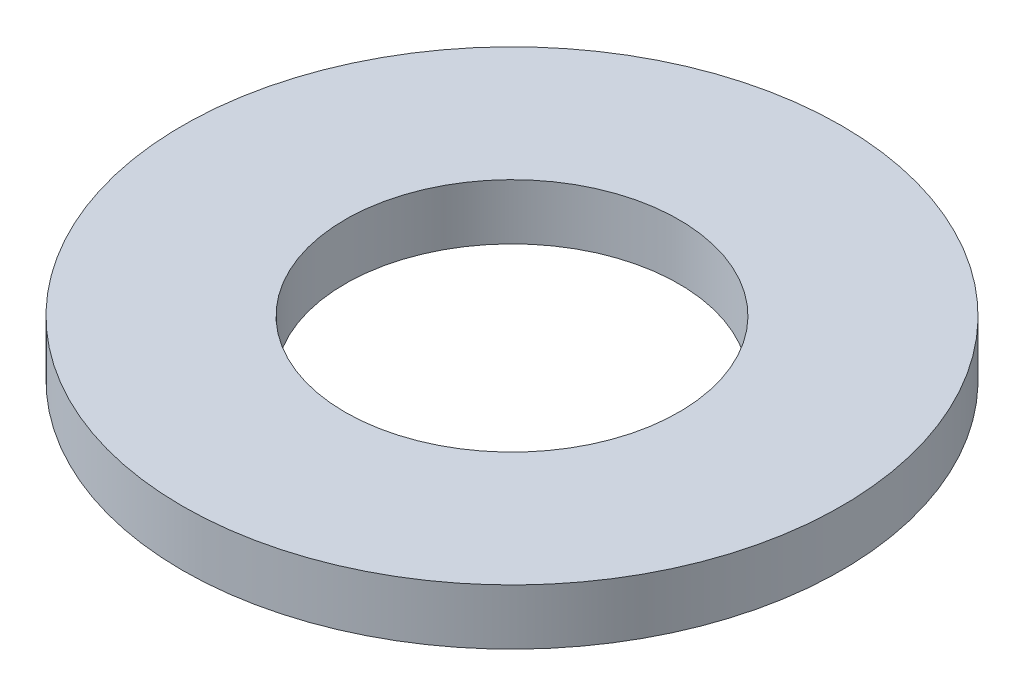
from build123d import *

# Parameters (mm, degrees)
SKETCH1_R           = 11.85
SKETCH1_R_2         = 6
BOSS_EXTRUDE1_DEPTH = 2


with BuildPart() as part:
    # Sketch1 → Boss-Extrude1 (new body)
    with BuildSketch(Plane(origin=(0, 0, 0), x_dir=(1, 0, 0), z_dir=(0, 1, 0))):
        with Locations(Location((0, 0, 0), (0, 0, 270))):
            Circle(SKETCH1_R)
        with Locations(Location((0, 0, 0), (0, 0, 270))):
            Circle(SKETCH1_R_2, mode=Mode.SUBTRACT)
    extrude(amount=BOSS_EXTRUDE1_DEPTH)


solid = part.part
